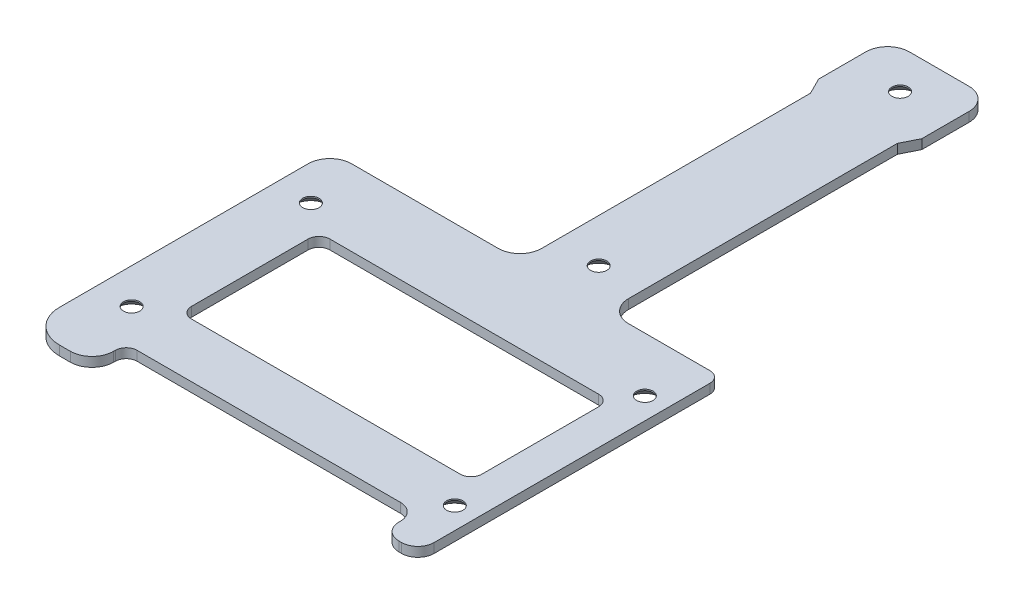
from build123d import *

# Parameters (mm, degrees)
SKETCH1_R           = 1.5
BOSS_EXTRUDE1_DEPTH = 1.75
CHAMFER1_SIZE       = 1.5


with BuildPart() as part:
    # Sketch1 → Boss-Extrude1 (new body)
    with BuildSketch(Plane(origin=(0, 0, 0), x_dir=(1, 0, 0), z_dir=(0, 1, 0))):
        with BuildLine():
            Line((8, 0), (8, 47))
            Line((8, 47), (9.5, 50))
            Line((9.5, 50), (9.5, 58.7))
            ThreePointArc((9.5, 58.7), (8.328427125, 61.528427125), (5.5, 62.7))
            Line((5.5, 62.7), (-5.5, 62.7))
            ThreePointArc((-5.5, 62.7), (-8.328427125, 61.528427125), (-9.5, 58.7))
            Line((-9.5, 58.7), (-9.5, 50))
            Line((-9.5, 50), (-8, 47))
            Line((-8, 47), (-8, 0))
            Line((-8, 0), (-8, -2.5))
            ThreePointArc((-8, -2.5), (-9.171572875, -5.328427125), (-12, -6.5))
            Line((-12, -6.5), (-39, -6.5))
            ThreePointArc((-39, -6.5), (-41.828427125, -7.671572875), (-43, -10.5))
            Line((-43, -10.5), (-43, -56))
            Line((-43, -56), (-43, -56.3))
            ThreePointArc((-43, -56.3), (-41.242640687, -60.542640687), (-37, -62.3))
            Line((-37, -62.3), (-35, -62.3))
            ThreePointArc((-35, -62.3), (-32.171572875, -61.128427125), (-31, -58.3))
            Line((-31, -58.3), (-31, -58))
            ThreePointArc((-31, -58), (-30.414213562, -56.585786438), (-29, -56))
            Line((-29, -56), (19.5, -56))
            ThreePointArc((19.5, -56), (21.621320344, -56.878679656), (22.5, -59))
            Line((22.5, -59), (22.5, -59.3))
            ThreePointArc((22.5, -59.3), (23.378679656, -61.421320344), (25.5, -62.3))
            Line((25.5, -62.3), (26, -62.3))
            ThreePointArc((26, -62.3), (28.121320344, -61.421320344), (29, -59.3))
            Line((29, -59.3), (29, -56))
            Line((29, -56), (29, -8.5))
            ThreePointArc((29, -8.5), (28.414213562, -7.085786438), (27, -6.5))
            Line((27, -6.5), (12, -6.5))
            ThreePointArc((12, -6.5), (9.171572875, -5.328427125), (8, -2.5))
            Line((8, -2.5), (8, 0))
        make_face()
        with Locations(Location((0, 0, 0), (0, 0, 270))):
            Circle(SKETCH1_R, mode=Mode.SUBTRACT)
        with Locations(Location((0, 55.5, 0), (0, 0, 270))):
            Circle(SKETCH1_R, mode=Mode.SUBTRACT)
        with Locations(Location((25, -16.5, 0), (0, 0, 270))):
            Circle(SKETCH1_R, mode=Mode.SUBTRACT)
        with Locations(Location((25, -51.5, 0), (0, 0, 270))):
            Circle(SKETCH1_R, mode=Mode.SUBTRACT)
        with Locations(Location((-36.5, -16.5, 0), (0, 0, 270))):
            Circle(SKETCH1_R, mode=Mode.SUBTRACT)
        with Locations(Location((-36.5, -49.5, 0), (0, 0, 270))):
            Circle(SKETCH1_R, mode=Mode.SUBTRACT)
        with BuildLine():
            Line((-31, -22.5), (-31, -44))
            ThreePointArc((-31, -44), (-30.414213562, -45.414213562), (-29, -46))
            Line((-29, -46), (20.5, -46))
            ThreePointArc((20.5, -46), (21.914213562, -45.414213562), (22.5, -44))
            Line((22.5, -44), (22.5, -22.5))
            ThreePointArc((22.5, -22.5), (21.914213562, -21.085786438), (20.5, -20.5))
            Line((20.5, -20.5), (-29, -20.5))
            ThreePointArc((-29, -20.5), (-30.414213562, -21.085786438), (-31, -22.5))
        make_face(mode=Mode.SUBTRACT)
    extrude(amount=BOSS_EXTRUDE1_DEPTH)

    # Chamfer1
    chamfer1_edges = [part.edges().sort_by_distance(p)[0] for p in [
        (25, 0, 15),
        (25, 0, 50),
        (-36.5, 0, 15),
        (-36.5, 0, 48),
        (0, 0, -1.5),
        (0, 0, -57),
    ]]
    chamfer(chamfer1_edges, length=CHAMFER1_SIZE)


solid = part.part
